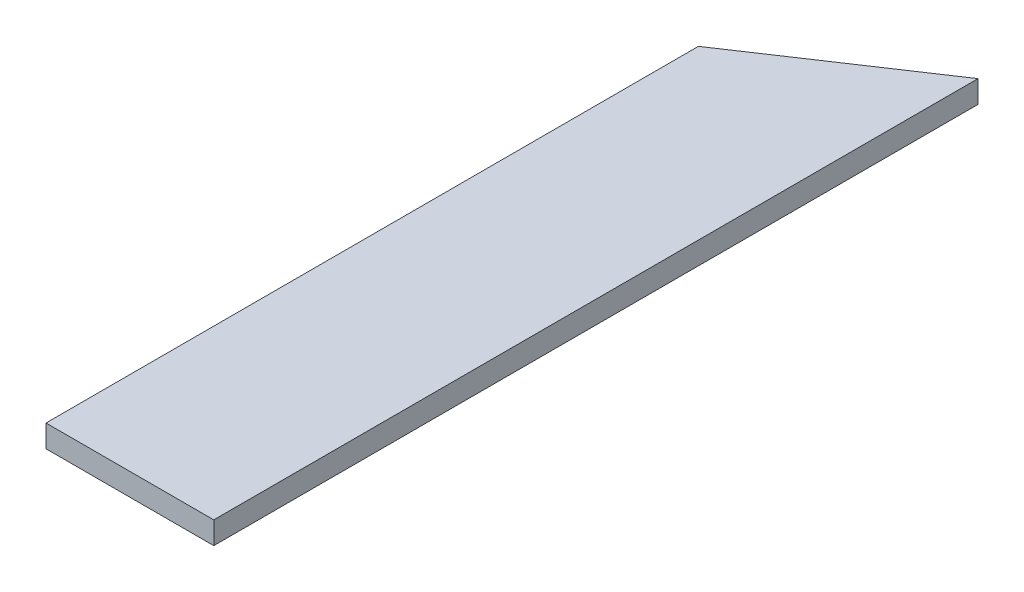
from build123d import *

# Parameters (mm, degrees)
SKETCH1_W           = 22.86
SKETCH1_H           = 88.9
BOSS_EXTRUDE1_DEPTH = 4.318
SKETCH2_W           = 60.750131803
SKETCH2_H           = 191.324729846
CUT_EXTRUDE1_DEPTH  = 1.27


with BuildPart() as part:
    # Sketch1 → Boss-Extrude1 (new body)
    with BuildSketch(Plane(origin=(0, 0, 0), x_dir=(1, 0, 0), z_dir=(0, 1, 0))):
        Polygon((0, 88.9), (22.86, 104.14), (22.86, 88.9), align=None)
        with Locations((11.43, 44.45)):
            Rectangle(SKETCH1_W, SKETCH1_H)
    extrude(amount=BOSS_EXTRUDE1_DEPTH)

    # Sketch2 → Cut-Extrude1 (cut)
    with BuildSketch(Plane(origin=(0, 4.318, 0), x_dir=(1, 0, 0), z_dir=(0, 1, 0))):
        with Locations((18.542677223, 60.872732731)):
            Rectangle(SKETCH2_W, SKETCH2_H)
    extrude(amount=-CUT_EXTRUDE1_DEPTH, mode=Mode.SUBTRACT)


solid = part.part
